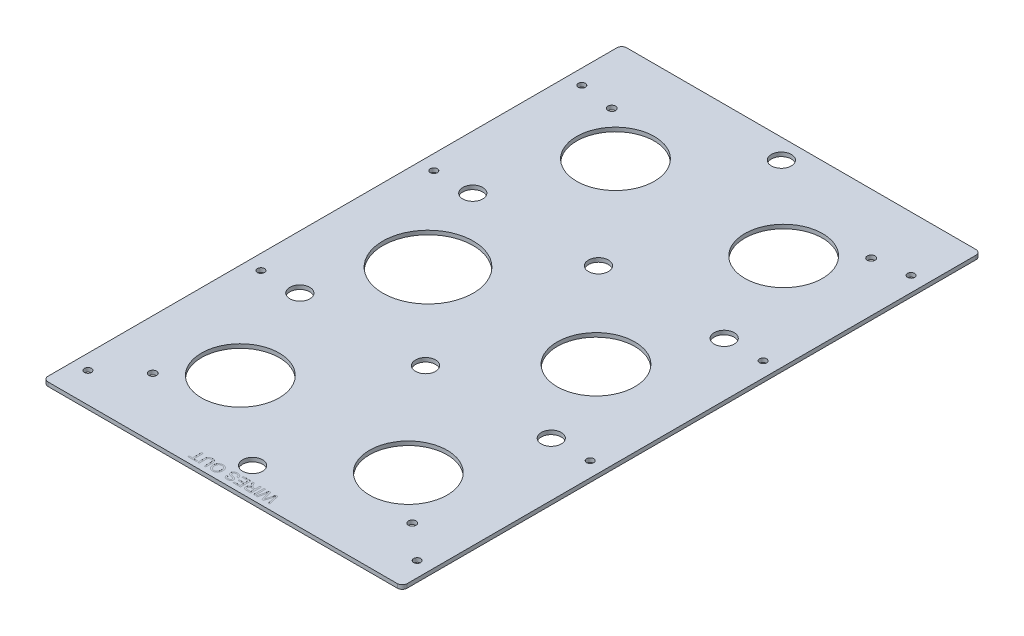
from build123d import *

# Parameters (mm, degrees)
SKETCH1_R           = 24.727
SKETCH1_R_2         = 28.76928198
SKETCH1_R_3         = 6.35
SKETCH1_R_4         = 2.45745
SKETCH1_R_5         = 2.2479
BOSS_EXTRUDE1_DEPTH = 2.54
SKETCH2_W           = 0.941716851
SKETCH2_H           = 6.677628581
CUT_EXTRUDE2_DEPTH  = 0.0254


with BuildPart() as part:
    # Sketch1 → Boss-Extrude1 (new body)
    with BuildSketch(Plane(origin=(0, 0, 0), x_dir=(1, 0, 0), z_dir=(0, 1, 0))):
        with BuildLine():
            Line((-56.121310553, 212.595268584), (166.128689447, 212.595268584))
            ThreePointArc((166.128689447, 212.595268584), (168.373753477, 211.665332614), (169.303689447, 209.420268584))
            Line((169.303689447, 209.420268584), (169.303689447, -152.529731416))
            ThreePointArc((169.303689447, -152.529731416), (168.373753477, -154.774795446), (166.128689447, -155.704731416))
            Line((166.128689447, -155.704731416), (-56.121310553, -155.704731416))
            ThreePointArc((-56.121310553, -155.704731416), (-58.366374583, -154.774795446), (-59.296310553, -152.529731416))
            Line((-59.296310553, -152.529731416), (-59.296310553, 209.420268584))
            ThreePointArc((-59.296310553, 209.420268584), (-58.366374583, 211.665332614), (-56.121310553, 212.595268584))
        make_face()
        with Locations(Location((108.521489447, -91.0633131, 0), (0, 0, 270))):
            Circle(SKETCH1_R, mode=Mode.SUBTRACT)
        with Locations(Location((108.521489447, 28.380977742, 0), (0, 0, 270))):
            Circle(SKETCH1_R, mode=Mode.SUBTRACT)
        with Locations(Location((1.485889447, -90.934731416, 0), (0, 0, 270))):
            Circle(SKETCH1_R, mode=Mode.SUBTRACT)
        with Locations(Location((1.485889447, 147.825268584, 0), (0, 0, 270))):
            Circle(SKETCH1_R, mode=Mode.SUBTRACT)
        with Locations(Location((108.521489447, 147.825268584, 0), (0, 0, 270))):
            Circle(SKETCH1_R, mode=Mode.SUBTRACT)
        with Locations(Location((1.485889447, 28.509559426, 0), (0, 0, 270))):
            Circle(SKETCH1_R_2, mode=Mode.SUBTRACT)
        with Locations(Location((55.003689447, -136.654731416, 0), (0, 0, 270))):
            Circle(SKETCH1_R_3, mode=Mode.SUBTRACT)
        with Locations(Location((135.013689447, -26.583831416, 0), (0, 0, 270))):
            Circle(SKETCH1_R_3, mode=Mode.SUBTRACT)
        with Locations(Location((55.003689447, -26.588064749, 0), (0, 0, 270))):
            Circle(SKETCH1_R_3, mode=Mode.SUBTRACT)
        with Locations(Location((-25.006310553, -26.583831416, 0), (0, 0, 270))):
            Circle(SKETCH1_R_3, mode=Mode.SUBTRACT)
        with Locations(Location((135.013689447, 83.474368584, 0), (0, 0, 270))):
            Circle(SKETCH1_R_3, mode=Mode.SUBTRACT)
        with Locations(Location((55.003689447, 83.478601917, 0), (0, 0, 270))):
            Circle(SKETCH1_R_3, mode=Mode.SUBTRACT)
        with Locations(Location((-25.006310553, 83.474368584, 0), (0, 0, 270))):
            Circle(SKETCH1_R_3, mode=Mode.SUBTRACT)
        with Locations(Location((55.003689447, 199.895268584, 0), (0, 0, 270))):
            Circle(SKETCH1_R_3, mode=Mode.SUBTRACT)
        with Locations(Location((137.553689447, 174.495268584, 0), (0, 0, 270))):
            Circle(SKETCH1_R_4, mode=Mode.SUBTRACT)
        with Locations(Location((-27.546310553, 174.495268584, 0), (0, 0, 270))):
            Circle(SKETCH1_R_4, mode=Mode.SUBTRACT)
        with Locations(Location((-27.546310553, -117.604731416, 0), (0, 0, 270))):
            Circle(SKETCH1_R_4, mode=Mode.SUBTRACT)
        with Locations(Location((137.553689447, -117.604731416, 0), (0, 0, 270))):
            Circle(SKETCH1_R_4, mode=Mode.SUBTRACT)
        with Locations(Location((-49.771310553, 177.670268584, 0), (0, 0, 270))):
            Circle(SKETCH1_R_5, mode=Mode.SUBTRACT)
        with Locations(Location((-49.771310553, 83.478601917, 0), (0, 0, 270))):
            Circle(SKETCH1_R_5, mode=Mode.SUBTRACT)
        with Locations(Location((159.778689447, 177.670268584, 0), (0, 0, 270))):
            Circle(SKETCH1_R_5, mode=Mode.SUBTRACT)
        with Locations(Location((159.778689447, 83.478601917, 0), (0, 0, 270))):
            Circle(SKETCH1_R_5, mode=Mode.SUBTRACT)
        with Locations(Location((159.778689447, -26.588064749, 0), (0, 0, 270))):
            Circle(SKETCH1_R_5, mode=Mode.SUBTRACT)
        with Locations(Location((-49.771310553, -26.588064749, 0), (0, 0, 270))):
            Circle(SKETCH1_R_5, mode=Mode.SUBTRACT)
        with Locations(Location((-49.771310553, -136.654731416, 0), (0, 0, 270))):
            Circle(SKETCH1_R_5, mode=Mode.SUBTRACT)
        with Locations(Location((159.778689447, -136.654731416, 0), (0, 0, 270))):
            Circle(SKETCH1_R_5, mode=Mode.SUBTRACT)
    extrude(amount=BOSS_EXTRUDE1_DEPTH)

    # Sketch2 → Cut-Extrude2 (cut)
    # profile 1 of 8: a face of its own
    with BuildSketch(Plane(origin=(0, 2.54, 0), x_dir=(1, 0, 0), z_dir=(0, 1, 0))):
        with BuildLine():
            Line((80.029279661, -145.704731416), (81.7107258, -152.382359997))
            Line((81.7107258, -152.382359997), (80.738242631, -152.382359997))
            Line((80.738242631, -152.382359997), (79.747032138, -147.990802579))
            add(Edge.make_bspline(
                [(79.747032138, -147.990802579), (79.695661446, -147.764312224), (79.593444513, -147.313643795), (79.492338116, -146.862724924), (79.442044295, -146.638422271)],
                knots=[0, 0, 0, 0, 1.00513078, 2, 2, 2, 2], degree=3))
            add(Edge.make_bspline(
                [(79.442044295, -146.638422271), (79.418231748, -146.719075954), (79.373278, -146.87133541), (79.312509244, -147.08717786), (79.25731493, -147.27555915), (79.210292208, -147.437357484), (79.172218091, -147.572800178), (79.139345331, -147.680222921), (79.116939668, -147.761729399), (79.103662032, -147.806664191), (79.098264137, -147.824931997)],
                knots=[0, 0, 0, 0, 1.633809233, 3.084334118, 4.356383392, 5.447555203, 6.357852567, 7.089694452, 7.629924063, 8, 8, 8, 8], degree=3))
            Line((79.098264137, -147.824931997), (77.779325479, -152.382359997))
            Line((77.779325479, -152.382359997), (76.646322393, -152.382359997))
            Line((76.646322393, -152.382359997), (75.692566548, -149.036857377))
            add(Edge.make_bspline(
                [(75.692566548, -149.036857377), (75.639932506, -148.830185346), (75.536149567, -148.422672829), (75.398257182, -147.81566784), (75.270986917, -147.223388915), (75.197676855, -146.831660892), (75.161513153, -146.638422271)],
                knots=[0, 0, 0, 0, 1.04154457, 2.053700482, 3.039894486, 4, 4, 4, 4], degree=3))
            add(Edge.make_bspline(
                [(75.161513153, -146.638422271), (75.139132616, -146.736944292), (75.091854028, -146.94507076), (75.019147923, -147.273539991), (74.936629564, -147.63395597), (74.880486071, -147.885100536), (74.851174645, -148.016218233)],
                knots=[0, 0, 0, 0, 0.858436457, 1.813435672, 2.858437265, 4, 4, 4, 4], degree=3))
            Line((74.851174645, -148.016218233), (73.865314817, -152.382359997))
            Line((73.865314817, -152.382359997), (72.892831648, -152.382359997))
            Line((72.892831648, -152.382359997), (74.575615453, -145.704731416))
            Line((74.575615453, -145.704731416), (75.610968923, -145.704731416))
            Line((75.610968923, -145.704731416), (77.006154542, -150.807927136))
            add(Edge.make_bspline(
                [(77.006154542, -150.807927136), (77.020164215, -150.857815617), (77.046777378, -150.952585154), (77.081661001, -151.087824496), (77.116254037, -151.206761932), (77.143769386, -151.310934535), (77.167581617, -151.399292569), (77.188668366, -151.471577335), (77.202230796, -151.529203562), (77.212038516, -151.561956596), (77.216168101, -151.57574741)],
                knots=[0, 0, 0, 0, 1.562239628, 2.967673567, 4.210417925, 5.296319877, 6.215971374, 6.969386481, 7.566055473, 8, 8, 8, 8], degree=3))
            add(Edge.make_bspline(
                [(77.216168101, -151.57574741), (77.240993719, -151.488311611), (77.288018835, -151.322689209), (77.356503208, -151.089823335), (77.415382597, -150.885483445), (77.452024197, -150.759319766), (77.468986972, -150.700913858)],
                knots=[0, 0, 0, 0, 1.197732026, 2.268764715, 3.198546125, 4, 4, 4, 4], degree=3))
            Line((77.468986972, -150.700913858), (78.915003898, -145.704731416))
            Line((78.915003898, -145.704731416), (80.029279661, -145.704731416))
        make_face()
    # profile 2 of 8: a face of its own
    with BuildSketch(Plane(origin=(0, 2.54, 0), x_dir=(1, 0, 0), z_dir=(0, 1, 0))):
        with Locations((71.737088239, -149.043545707)):
            Rectangle(SKETCH2_W, SKETCH2_H)
    # profile 3 of 8: a face of its own
    with BuildSketch(Plane(origin=(0, 2.54, 0), x_dir=(1, 0, 0), z_dir=(0, 1, 0))):
        with BuildLine():
            Line((69.725238603, -145.704731416), (69.725238603, -152.382359997))
            Line((69.725238603, -152.382359997), (66.827854087, -152.382359997))
            add(Edge.make_bspline(
                [(66.827854087, -152.382359997), (66.759629228, -152.381827962), (66.627588, -152.380798272), (66.436106253, -152.373440351), (66.25779954, -152.357808443), (66.091544097, -152.340349513), (65.937624411, -152.314571062), (65.795967128, -152.28432829), (65.667115536, -152.248584849), (65.550089215, -152.20633462), (65.441505485, -152.158550478), (65.340885212, -152.099559989), (65.243907957, -152.035030329), (65.154439449, -151.958586204), (65.068450058, -151.876455256), (64.989539904, -151.78452804), (64.915373648, -151.685105409), (64.825197278, -151.541131601), (64.730487537, -151.348144969), (64.648912432, -151.102957418), (64.597041436, -150.846216607), (64.591442148, -150.670841687), (64.588601234, -150.581861585)],
                knots=[0, 0, 0, 0, 1.242075696, 2.40389213, 3.487198984, 4.500157661, 5.446319301, 6.326791195, 7.136300648, 7.878370406, 8.590488565, 9.292260633, 9.999224673, 10.708050372, 11.431369221, 12.162165018, 12.910600795, 13.687589445, 15.252257874, 16.810406251, 18.381693487, 20, 20, 20, 20], degree=3))
            add(Edge.make_bspline(
                [(64.588601234, -150.581861585), (64.589907939, -150.524740088), (64.592488773, -150.411921213), (64.612257927, -150.246047086), (64.648029381, -150.087561728), (64.693896712, -149.935073876), (64.756684454, -149.790755988), (64.829388085, -149.651615869), (64.919584598, -149.521641487), (65.020293841, -149.396488972), (65.13740046, -149.281806219), (65.267662733, -149.175811763), (65.41499687, -149.084850699), (65.574570578, -149.000318383), (65.750496328, -148.930895346), (65.940120993, -148.869766111), (66.14491216, -148.822633746), (66.286855968, -148.798892657), (66.359670993, -148.786713838)],
                knots=[0, 0, 0, 0, 0.982645791, 1.940792824, 2.867691729, 3.775150443, 4.675643875, 5.571354211, 6.471357401, 7.392684514, 8.331098131, 9.285922955, 10.275520706, 11.304845665, 12.388884831, 13.524255008, 14.729980297, 16, 16, 16, 16], degree=3))
            add(Edge.make_bspline(
                [(66.359670993, -148.786713838), (66.305740634, -148.75983205), (66.203466532, -148.708853145), (66.064293374, -148.624504804), (65.942371498, -148.545098059), (65.873114839, -148.485554196), (65.840656592, -148.457648007)],
                knots=[0, 0, 0, 0, 1.172551213, 2.223638478, 3.167479604, 4, 4, 4, 4], degree=3))
            add(Edge.make_bspline(
                [(65.840656592, -148.457648007), (65.777468442, -148.395895573), (65.64787995, -148.2692515), (65.471039527, -148.051539052), (65.296058038, -147.81211767), (65.191002805, -147.6376469), (65.137044286, -147.548035139)],
                knots=[0, 0, 0, 0, 0.918170575, 1.883016652, 2.912673989, 4, 4, 4, 4], degree=3))
            Line((65.137044286, -147.548035139), (64.041495847, -145.704731416))
            Line((64.041495847, -145.704731416), (65.120992294, -145.704731416))
            Line((65.120992294, -145.704731416), (65.953020535, -147.114631361))
            add(Edge.make_bspline(
                [(65.953020535, -147.114631361), (65.982937923, -147.164098167), (66.040912909, -147.259956715), (66.12462569, -147.399973664), (66.206813768, -147.528808538), (66.282671411, -147.650471976), (66.357009397, -147.761755466), (66.423648427, -147.866870579), (66.490571396, -147.959862494), (66.567413815, -148.071581699), (66.661257567, -148.192370364), (66.770766589, -148.316455456), (66.871452849, -148.419242035), (66.998685638, -148.517314097), (67.156892938, -148.607108645), (67.290284254, -148.649704776), (67.354894484, -148.670336898)],
                knots=[0, 0, 0, 0, 1.130591283, 2.190900266, 3.190104209, 4.119071823, 4.994606968, 5.807262858, 6.55236009, 7.234593472, 8.459046683, 9.540234366, 10.471327768, 11.266723835, 12.676093724, 14, 14, 14, 14], degree=3))
            add(Edge.make_bspline(
                [(67.354894484, -148.670336898), (67.382037121, -148.675231638), (67.444004575, -148.686406476), (67.549225158, -148.69370478), (67.676712802, -148.701450954), (67.769105271, -148.701225256), (67.819064579, -148.701103215)],
                knots=[0, 0, 0, 0, 0.709978628, 1.620902492, 2.713552433, 4, 4, 4, 4], degree=3))
            Line((67.819064579, -148.701103215), (68.783521752, -148.701103215))
            Line((68.783521752, -148.701103215), (68.783521752, -145.704731416))
            Line((68.783521752, -145.704731416), (69.725238603, -145.704731416))
        make_face()
        with BuildLine():
            Line((68.783521752, -149.471598821), (66.995062335, -149.471598821))
            add(Edge.make_bspline(
                [(66.995062335, -149.471598821), (66.905378152, -149.472989815), (66.737721983, -149.47559015), (66.503340952, -149.498134703), (66.302851091, -149.533375071), (66.133691433, -149.586899254), (65.991529233, -149.658578696), (65.868316922, -149.746235717), (65.764716885, -149.854984869), (65.679514802, -149.97968191), (65.612910025, -150.115575815), (65.566369983, -150.259402832), (65.53512463, -150.408405004), (65.531929843, -150.510360449), (65.530318085, -150.561796596)],
                knots=[0, 0, 0, 0, 1.546056516, 2.890207646, 4.055830773, 5.050253158, 5.937355789, 6.790906573, 7.644595853, 8.512568064, 9.38593768, 10.244184789, 11.114197691, 12, 12, 12, 12], degree=3))
            add(Edge.make_bspline(
                [(65.530318085, -150.561796596), (65.531555421, -150.599281171), (65.533978998, -150.672702444), (65.546819416, -150.78042932), (65.571249426, -150.882517958), (65.604983943, -150.979704261), (65.647696765, -151.072199236), (65.700184065, -151.159639095), (65.762175013, -151.241577229), (65.833285898, -151.318417024), (65.91490542, -151.38834434), (66.008142078, -151.448673601), (66.112251337, -151.49994125), (66.227356803, -151.540630467), (66.353095126, -151.573175281), (66.490182326, -151.59482628), (66.637991409, -151.610492876), (66.740414535, -151.611398678), (66.793074771, -151.611864391)],
                knots=[0, 0, 0, 0, 0.965235723, 1.89061323, 2.787065514, 3.661873922, 4.534873316, 5.404925039, 6.281839248, 7.175200054, 8.095223355, 9.040740021, 10.02630299, 11.075573487, 12.177989335, 13.364883635, 14.645170704, 16, 16, 16, 16], degree=3))
            Line((66.793074771, -151.611864391), (68.783521752, -151.611864391))
            Line((68.783521752, -151.611864391), (68.783521752, -149.471598821))
        make_face(mode=Mode.SUBTRACT)
    # profile 4 of 8: a face of its own
    with BuildSketch(Plane(origin=(0, 2.54, 0), x_dir=(1, 0, 0), z_dir=(0, 1, 0))):
        Polygon((63.047610023, -145.704731416), (63.047610023, -152.382359997), (58.339025767, -152.382359997), (58.339025767, -151.611864391), (62.105893172, -151.611864391), (62.105893172, -149.557209443), (58.595857635, -149.557209443), (58.595857635, -148.786713838), (62.105893172, -148.786713838), (62.105893172, -146.475227022), (58.167804521, -146.475227022), (58.167804521, -145.704731416), align=None)
    # profile 5 of 8: a face of its own
    with BuildSketch(Plane(origin=(0, 2.54, 0), x_dir=(1, 0, 0), z_dir=(0, 1, 0))):
        with BuildLine():
            Line((57.22608767, -148.016218233), (56.284370819, -148.016218233))
            add(Edge.make_bspline(
                [(56.284370819, -148.016218233), (56.274036117, -147.931652183), (56.254182596, -147.769196247), (56.198230694, -147.539143921), (56.127744398, -147.331765305), (56.034997955, -147.147273237), (55.92108129, -146.981277245), (55.778553671, -146.834274944), (55.607402601, -146.705232553), (55.411663162, -146.594893332), (55.197484631, -146.5019483), (54.966757588, -146.436745749), (54.722897055, -146.39720687), (54.55581207, -146.392182119), (54.470495748, -146.389616399)],
                knots=[0, 0, 0, 0, 1.125761249, 2.162647979, 3.12492346, 4.01623828, 4.884793378, 5.777219259, 6.711258599, 7.709587174, 8.742442187, 9.791331093, 10.872217593, 12, 12, 12, 12], degree=3))
            add(Edge.make_bspline(
                [(54.470495748, -146.389616399), (54.395012142, -146.391020079), (54.248275368, -146.39374877), (54.035161199, -146.426314589), (53.835192167, -146.474492858), (53.650528629, -146.543784278), (53.484881741, -146.630884243), (53.337848957, -146.730338577), (53.21590082, -146.848862493), (53.117256921, -146.97986137), (53.040703733, -147.118970535), (52.987333539, -147.262482959), (52.951401229, -147.407604013), (52.947495522, -147.505916251), (52.945556529, -147.554723469)],
                knots=[0, 0, 0, 0, 1.267544124, 2.464049433, 3.614542348, 4.719673496, 5.768837234, 6.754183997, 7.692231426, 8.612479311, 9.501217876, 10.350240008, 11.180974857, 12, 12, 12, 12], degree=3))
            add(Edge.make_bspline(
                [(52.945556529, -147.554723469), (52.947602205, -147.603051819), (52.951604584, -147.697606546), (52.983354602, -147.83448118), (53.034659483, -147.961839203), (53.106627636, -148.080767085), (53.204438753, -148.190545656), (53.330920283, -148.287996323), (53.482548856, -148.38068759), (53.596709803, -148.430119962), (53.657194831, -148.456310341)],
                knots=[0, 0, 0, 0, 0.942081658, 1.843188798, 2.725198023, 3.611401405, 4.541884661, 5.575766242, 6.715586633, 8, 8, 8, 8], degree=3))
            add(Edge.make_bspline(
                [(53.657194831, -148.456310341), (53.680720403, -148.465964594), (53.733868945, -148.487775307), (53.824963937, -148.516645948), (53.933055061, -148.553995036), (54.060353956, -148.592260466), (54.206992519, -148.633260146), (54.371625653, -148.680444223), (54.555559453, -148.729579011), (54.752352418, -148.781595403), (54.951550784, -148.834355039), (55.141834246, -148.888300752), (55.317983836, -148.939465805), (55.479329045, -148.99205191), (55.626024384, -149.043952649), (55.758470628, -149.094832643), (55.876903383, -149.143425756), (55.949235832, -149.179162423), (55.983395973, -149.196039628)],
                knots=[0, 0, 0, 0, 0.499208779, 1.12780332, 1.87546358, 2.745246929, 3.737578632, 4.865834649, 6.108484299, 7.476352792, 8.863398792, 10.155242256, 11.360521946, 12.465428895, 13.487415091, 14.415997097, 15.251929613, 16, 16, 16, 16], degree=3))
            add(Edge.make_bspline(
                [(55.983395973, -149.196039628), (56.061939332, -149.238549093), (56.213548457, -149.320603422), (56.418387849, -149.466445689), (56.588087262, -149.631435602), (56.728032509, -149.809204512), (56.836079416, -150.000673688), (56.912416665, -150.203746025), (56.96199253, -150.417629242), (56.96680774, -150.56464044), (56.969255802, -150.639381223)],
                knots=[0, 0, 0, 0, 1.158956011, 2.237086722, 3.252429106, 4.221720014, 5.165272549, 6.094237939, 7.031106807, 8, 8, 8, 8], degree=3))
            add(Edge.make_bspline(
                [(56.969255802, -150.639381223), (56.966081922, -150.722169384), (56.959769099, -150.886834437), (56.903631, -151.128422791), (56.814219476, -151.361652776), (56.711224913, -151.546243423), (56.612252857, -151.686400222), (56.529071871, -151.785780629), (56.437284812, -151.878203422), (56.33889894, -151.965586195), (56.230361925, -152.044661593), (56.114924838, -152.118074619), (55.990222979, -152.183860466), (55.81367115, -152.264065642), (55.578842787, -152.346297072), (55.283173868, -152.417541618), (54.971970371, -152.459247391), (54.759556851, -152.465021748), (54.651080655, -152.46797062)],
                knots=[0, 0, 0, 0, 1.200056028, 2.386902731, 3.579012093, 4.815906327, 5.442508847, 6.067203999, 6.694073756, 7.331409728, 7.974631341, 8.640655778, 9.315145047, 10.018831381, 11.453504181, 12.917815188, 14.425977399, 16, 16, 16, 16], degree=3))
            add(Edge.make_bspline(
                [(54.651080655, -152.46797062), (54.532328079, -152.465335452), (54.301536136, -152.460214087), (53.965948585, -152.415048168), (53.652011121, -152.342269778), (53.406259629, -152.256526219), (53.224097329, -152.171298161), (53.09569649, -152.102618852), (52.976105466, -152.025216619), (52.863042146, -151.943262026), (52.760547182, -151.851416675), (52.664387424, -151.75451086), (52.576180596, -151.650676539), (52.471432464, -151.502375157), (52.360787582, -151.304042733), (52.26086547, -151.049659933), (52.196879074, -150.779183734), (52.182410966, -150.5933387), (52.175060923, -150.498926295)],
                knots=[0, 0, 0, 0, 1.607451709, 3.124032445, 4.575401297, 5.965664223, 6.638286369, 7.297495781, 7.935629741, 8.566004073, 9.186263309, 9.796807256, 10.413736732, 11.028594479, 12.253110936, 13.478624344, 14.719098735, 16, 16, 16, 16], degree=3))
            Line((52.175060923, -150.498926295), (53.116777774, -150.498926295))
            add(Edge.make_bspline(
                [(53.116777774, -150.498926295), (53.12256482, -150.546790135), (53.1339, -150.640541808), (53.165699429, -150.775279325), (53.203736155, -150.901835006), (53.252104235, -151.018786484), (53.309830176, -151.127167922), (53.37830271, -151.225743174), (53.454811782, -151.316377881), (53.541203273, -151.397481453), (53.638294539, -151.46870712), (53.746105914, -151.530263898), (53.864237666, -151.582876538), (53.993835671, -151.623436732), (54.133167052, -151.657118748), (54.283834793, -151.681296537), (54.445312172, -151.693821225), (54.556533166, -151.696235632), (54.613626008, -151.697475014)],
                knots=[0, 0, 0, 0, 1.074256797, 2.104164074, 3.082231143, 4.018364317, 4.921387537, 5.814946689, 6.689553043, 7.561782592, 8.450683137, 9.368204304, 10.325224224, 11.328240899, 12.391723181, 13.519579538, 14.726730929, 16, 16, 16, 16], degree=3))
            add(Edge.make_bspline(
                [(54.613626008, -151.697475014), (54.672972195, -151.697033587), (54.787851817, -151.696179094), (54.95388876, -151.680315804), (55.107908151, -151.658931698), (55.248960533, -151.626106316), (55.378362134, -151.587486496), (55.493843198, -151.535627275), (55.598156125, -151.477168085), (55.689398524, -151.408644046), (55.768042412, -151.332675231), (55.838626331, -151.254638279), (55.895538928, -151.17045065), (55.9456534, -151.084774031), (55.980571056, -150.99305167), (56.007980626, -150.899274119), (56.024647148, -150.801380567), (56.026561696, -150.734865537), (56.027538951, -150.700913858)],
                knots=[0, 0, 0, 0, 1.464224776, 2.834379057, 4.11387117, 5.299348816, 6.406355048, 7.441191667, 8.417293255, 9.352838038, 10.248153785, 11.113750317, 11.944205591, 12.75240885, 13.557683963, 14.358962649, 15.162355132, 16, 16, 16, 16], degree=3))
            add(Edge.make_bspline(
                [(56.027538951, -150.700913858), (56.025105333, -150.643462477), (56.020381904, -150.531954643), (55.972148797, -150.373535625), (55.89796594, -150.229126425), (55.824884006, -150.150554117), (55.78809674, -150.11100316)],
                knots=[0, 0, 0, 0, 1.050964922, 2.039826012, 3.013306874, 4, 4, 4, 4], degree=3))
            add(Edge.make_bspline(
                [(55.78809674, -150.11100316), (55.764906441, -150.091237481), (55.713622525, -150.047526901), (55.618200873, -149.989681153), (55.499892293, -149.931234951), (55.357905621, -149.873137007), (55.192488119, -149.814670252), (55.003893205, -149.754515149), (54.791046034, -149.694461366), (54.56099498, -149.637528445), (54.328914973, -149.579071519), (54.108668391, -149.52147128), (53.905664624, -149.467642831), (53.722241075, -149.41160268), (53.555379549, -149.362447621), (53.408387696, -149.31054747), (53.278624712, -149.263448691), (53.199158703, -149.230204154), (53.162258418, -149.214766952)],
                knots=[0, 0, 0, 0, 0.523895407, 1.158562347, 1.913798076, 2.79478753, 3.797549825, 4.933675542, 6.202127117, 7.604032848, 9.013379355, 10.32225155, 11.523321485, 12.628397413, 13.623935419, 14.51727859, 15.311493772, 16, 16, 16, 16], degree=3))
            add(Edge.make_bspline(
                [(53.162258418, -149.214766952), (53.114237299, -149.192642663), (53.019979891, -149.14921639), (52.886607207, -149.074857982), (52.761347407, -148.998303761), (52.648100997, -148.913945073), (52.541303271, -148.829473553), (52.446401397, -148.738152653), (52.361353982, -148.64213119), (52.260611548, -148.510201197), (52.157272926, -148.332129366), (52.068486422, -148.101983909), (52.012948169, -147.856092742), (52.006913414, -147.68655586), (52.003839678, -147.600204112)],
                knots=[0, 0, 0, 0, 0.899363591, 1.76530001, 2.59691609, 3.395188894, 4.166615117, 4.912545108, 5.632755751, 6.347510175, 7.734752518, 9.118421309, 10.532299558, 12, 12, 12, 12], degree=3))
            add(Edge.make_bspline(
                [(52.003839678, -147.600204112), (52.007379693, -147.512947481), (52.014425473, -147.339278427), (52.073306705, -147.083670735), (52.167783661, -146.836498404), (52.277131577, -146.640406238), (52.380908177, -146.490405381), (52.46805695, -146.382582695), (52.564707583, -146.282886624), (52.66847164, -146.188190253), (52.780157577, -146.100428246), (52.90070475, -146.019563988), (53.028847063, -145.944780918), (53.211805644, -145.853551254), (53.455094931, -145.758813104), (53.764044377, -145.676641079), (54.090829604, -145.627950211), (54.314714943, -145.622105191), (54.429028102, -145.619120793)],
                knots=[0, 0, 0, 0, 1.196987384, 2.382393894, 3.582009067, 4.820735309, 5.454243406, 6.085350439, 6.72189866, 7.359035515, 8.013098289, 8.67027723, 9.350744424, 10.048966745, 11.475869723, 12.9268444, 14.430883741, 16, 16, 16, 16], degree=3))
            add(Edge.make_bspline(
                [(54.429028102, -145.619120793), (54.501724447, -145.619797777), (54.644571207, -145.621128036), (54.854009777, -145.63431666), (55.054143614, -145.658144771), (55.245773398, -145.685725106), (55.427995129, -145.727177668), (55.601854388, -145.773949607), (55.765765293, -145.832626587), (55.921532804, -145.897184112), (56.067730879, -145.973465379), (56.207429169, -146.055221012), (56.337247096, -146.149004708), (56.461030966, -146.248461662), (56.575045939, -146.359105701), (56.680611206, -146.478354849), (56.77887416, -146.605938118), (56.868092721, -146.741993436), (56.947740021, -146.884960745), (57.019442486, -147.03235512), (57.07944818, -147.184962788), (57.128897857, -147.342424979), (57.169375954, -147.504026887), (57.19823807, -147.670844972), (57.219190157, -147.841832706), (57.223774919, -147.957746378), (57.22608767, -148.016218233)],
                knots=[0, 0, 0, 0, 1.259929758, 2.475735005, 3.634725603, 4.752877801, 5.82919746, 6.871690464, 7.871395985, 8.84458164, 9.791640072, 10.727373556, 11.647336026, 12.564665335, 13.477425593, 14.397128332, 15.323044476, 16.266184727, 17.214251675, 18.157898412, 19.105082968, 20.053433368, 21.01687335, 21.990151059, 22.98614553, 24, 24, 24, 24], degree=3))
        make_face()
    # profile 6 of 8: a face of its own
    with BuildSketch(Plane(origin=(0, 2.54, 0), x_dir=(1, 0, 0), z_dir=(0, 1, 0))):
        with BuildLine():
            add(Edge.make_bspline(
                [(48.493804142, -148.955259752), (48.491467599, -149.089135529), (48.486914966, -149.349985692), (48.444878562, -149.729899077), (48.375530549, -150.086921252), (48.280135178, -150.422703732), (48.153256187, -150.734714085), (48.002707821, -151.026789018), (47.820043627, -151.293844928), (47.613644944, -151.538969607), (47.383043857, -151.755657917), (47.137535236, -151.948113422), (46.874034222, -152.108642761), (46.59498038, -152.241187416), (46.299186796, -152.342951276), (45.987484329, -152.414195261), (45.660206242, -152.460154548), (45.436504015, -152.465327419), (45.322198099, -152.46797062)],
                knots=[0, 0, 0, 0, 1.203593535, 2.345140965, 3.431924157, 4.471254512, 5.478692091, 6.45615896, 7.42038538, 8.382007041, 9.33218277, 10.260966195, 11.182476517, 12.100814648, 13.034113903, 13.98924309, 14.972556454, 16, 16, 16, 16], degree=3))
            add(Edge.make_bspline(
                [(45.322198099, -152.46797062), (45.246803118, -152.466666047), (45.097082322, -152.464075401), (44.875336318, -152.443970034), (44.659554943, -152.409061507), (44.449611732, -152.360498158), (44.245197005, -152.299400427), (44.04644571, -152.223941082), (43.853040257, -152.135665273), (43.666712333, -152.033067288), (43.488785231, -151.917618035), (43.319985167, -151.79251744), (43.162934584, -151.655256349), (43.016875567, -151.507656459), (42.880679081, -151.349793667), (42.758697678, -151.178719662), (42.643711434, -150.999837338), (42.542898006, -150.809040243), (42.451508274, -150.610712696), (42.374904164, -150.403995115), (42.307064707, -150.191850055), (42.252288146, -149.972959882), (42.211457264, -149.746700078), (42.180059978, -149.514696505), (42.163106161, -149.275659739), (42.160126709, -149.114465609), (42.158618052, -149.032844379)],
                knots=[0, 0, 0, 0, 1.034176269, 2.053687022, 3.051235935, 4.030520976, 5.007759882, 5.975670013, 6.944584641, 7.921900115, 8.890679583, 9.85222947, 10.801660264, 11.7488817, 12.698942795, 13.658174729, 14.62880618, 15.613957309, 16.61577279, 17.622338666, 18.636016077, 19.670029534, 20.714984856, 21.788550191, 22.880224384, 24, 24, 24, 24], degree=3))
            add(Edge.make_bspline(
                [(42.158618052, -149.032844379), (42.160009382, -148.949878825), (42.162758195, -148.785966068), (42.181357784, -148.543816775), (42.214062327, -148.308619086), (42.257439336, -148.079671684), (42.315563203, -147.85745119), (42.384634487, -147.641320483), (42.468180105, -147.432566885), (42.562535617, -147.230687242), (42.669298792, -147.038458153), (42.787065988, -146.857223581), (42.915919864, -146.688679534), (43.053905959, -146.530755832), (43.203783041, -146.38672136), (43.364393449, -146.254432261), (43.535408741, -146.13445772), (43.716158567, -146.026090066), (43.903755164, -145.93080257), (44.095920731, -145.846594873), (44.292881899, -145.778463632), (44.49175709, -145.718034174), (44.695507697, -145.674582309), (44.90221245, -145.642203665), (45.113170034, -145.623270241), (45.254832495, -145.62051105), (45.326211097, -145.619120793)],
                knots=[0, 0, 0, 0, 1.141458971, 2.255149016, 3.338763392, 4.407145747, 5.45911027, 6.497028761, 7.526847988, 8.550472592, 9.561035647, 10.549629976, 11.521388012, 12.477647518, 13.432134385, 14.377847498, 15.337760086, 16.303574593, 17.274809663, 18.230970776, 19.187525402, 20.140611526, 21.088808525, 22.051011914, 23.017975238, 24, 24, 24, 24], degree=3))
            add(Edge.make_bspline(
                [(45.326211097, -145.619120793), (45.402948895, -145.620309681), (45.554947256, -145.62266457), (45.779842351, -145.644345492), (45.998398809, -145.681460676), (46.211866877, -145.728050436), (46.41787104, -145.793461052), (46.618134934, -145.870530878), (46.811173889, -145.963796859), (46.997979616, -146.069154763), (47.176878716, -146.185959466), (47.344078236, -146.315335396), (47.502045211, -146.452739616), (47.645968618, -146.603499345), (47.780158847, -146.762898302), (47.90416524, -146.932319795), (48.016235608, -147.112612503), (48.115748903, -147.302812003), (48.20548349, -147.498091438), (48.281127756, -147.698348896), (48.347593196, -147.900677047), (48.40052896, -148.10631126), (48.442711581, -148.314780295), (48.471076513, -148.525736434), (48.491561832, -148.739494085), (48.493052944, -148.882975927), (48.493804142, -148.955259752)],
                knots=[0, 0, 0, 0, 1.072846099, 2.125039441, 3.155166917, 4.171599398, 5.177324298, 6.174217088, 7.169783185, 8.172042761, 9.17156421, 10.154239632, 11.126115549, 12.096189878, 13.065322046, 14.038037562, 15.029377678, 16.03062832, 17.03785952, 18.032507603, 19.022297599, 20.014323703, 20.999862951, 21.994471951, 22.989647507, 24, 24, 24, 24], degree=3))
        make_face()
        with BuildLine():
            add(Edge.make_bspline(
                [(47.55208729, -148.944558424), (47.550644971, -148.848151817), (47.547832551, -148.660165739), (47.515627371, -148.386099128), (47.466818619, -148.12747685), (47.399344029, -147.883694112), (47.309257222, -147.656543018), (47.199115485, -147.445587371), (47.069916503, -147.249830078), (46.921728259, -147.071489589), (46.758902041, -146.911226752), (46.584902849, -146.77118446), (46.399892329, -146.654408047), (46.206319995, -146.556869438), (46.001619325, -146.481716297), (45.786771033, -146.428589759), (45.561779333, -146.395428666), (45.408370792, -146.391577959), (45.330224095, -146.389616399)],
                knots=[0, 0, 0, 0, 1.215616022, 2.370365452, 3.475740397, 4.533490648, 5.5560781, 6.552384115, 7.530550651, 8.509299237, 9.471863928, 10.40830403, 11.321168121, 12.226759389, 13.137923578, 14.065605683, 15.014614662, 16, 16, 16, 16], degree=3))
            add(Edge.make_bspline(
                [(45.330224095, -146.389616399), (45.250752104, -146.391605556), (45.095146171, -146.395500319), (44.866772386, -146.428101993), (44.649791707, -146.483604945), (44.442053557, -146.557491975), (44.247313311, -146.657374543), (44.061017796, -146.774336845), (43.888240741, -146.917260032), (43.724759335, -147.077811023), (43.578072709, -147.260286231), (43.448128555, -147.460286468), (43.341842815, -147.680297116), (43.253181458, -147.917154096), (43.183633952, -148.172343821), (43.135013735, -148.445864052), (43.105030043, -148.736993788), (43.101927623, -148.936903238), (43.100334903, -149.039532709)],
                knots=[0, 0, 0, 0, 0.976909331, 1.912785716, 2.828990727, 3.727421029, 4.617481149, 5.514840137, 6.426786422, 7.368873452, 8.327895072, 9.299698503, 10.295216142, 11.325792517, 12.405818789, 13.542541501, 14.738390493, 16, 16, 16, 16], degree=3))
            add(Edge.make_bspline(
                [(43.100334903, -149.039532709), (43.100903486, -149.105554772), (43.102018841, -149.235066167), (43.116789884, -149.425967441), (43.135842608, -149.610930612), (43.164850778, -149.789716918), (43.204827366, -149.961586304), (43.249115828, -150.127845986), (43.304492564, -150.287067658), (43.367340871, -150.43985966), (43.437610453, -150.58549569), (43.517069671, -150.722538432), (43.604030552, -150.8514426), (43.699393953, -150.971632766), (43.800749059, -151.084806113), (43.911322382, -151.188020439), (44.029292399, -151.283329151), (44.15467387, -151.369757222), (44.285454646, -151.447449459), (44.420970996, -151.514452815), (44.560791255, -151.571258814), (44.704771667, -151.615771008), (44.852045916, -151.652520297), (45.002969159, -151.679741754), (45.158723979, -151.694013149), (45.263761115, -151.696312772), (45.316847435, -151.697475014)],
                knots=[0, 0, 0, 0, 1.220320263, 2.393826742, 3.538159925, 4.657606474, 5.739544833, 6.799495376, 7.837090465, 8.853610905, 9.852768056, 10.824163015, 11.779900663, 12.724912201, 13.658747054, 14.586045767, 15.518168864, 16.460299482, 17.399069918, 18.328125852, 19.252745725, 20.186143833, 21.111865538, 22.057883325, 23.018444021, 24, 24, 24, 24], degree=3))
            add(Edge.make_bspline(
                [(45.316847435, -151.697475014), (45.391875075, -151.695959775), (45.54035477, -151.692961117), (45.758313263, -151.660557085), (45.968680565, -151.611773411), (46.169989069, -151.541307864), (46.36453317, -151.452843413), (46.550074066, -151.342701808), (46.727792545, -151.21319321), (46.896933348, -151.064868688), (47.054578213, -150.893751276), (47.187925289, -150.692139307), (47.300292819, -150.464699542), (47.394123674, -150.212050312), (47.465665272, -149.93222286), (47.515109926, -149.626424994), (47.546328144, -149.294333415), (47.550118497, -149.064130757), (47.55208729, -148.944558424)],
                knots=[0, 0, 0, 0, 0.895098135, 1.771399171, 2.624879489, 3.470001555, 4.31324378, 5.172350046, 6.041214072, 6.935108351, 7.854676913, 8.809932058, 9.809814619, 10.877726151, 12.02168834, 13.252153056, 14.572707754, 16, 16, 16, 16], degree=3))
        make_face(mode=Mode.SUBTRACT)
    # profile 7 of 8: a face of its own
    with BuildSketch(Plane(origin=(0, 2.54, 0), x_dir=(1, 0, 0), z_dir=(0, 1, 0))):
        with BuildLine():
            Line((36.765148814, -152.382359997), (35.823431963, -152.382359997))
            Line((35.823431963, -152.382359997), (35.823431963, -148.540583297))
            add(Edge.make_bspline(
                [(35.823431963, -148.540583297), (35.824411412, -148.45897922), (35.826317422, -148.300177551), (35.835036489, -148.068576242), (35.852184402, -147.849869969), (35.877863075, -147.644731811), (35.908551601, -147.451891603), (35.944806741, -147.272000632), (35.991007316, -147.105219306), (36.04286506, -146.949716853), (36.104617166, -146.804123123), (36.177639877, -146.666349763), (36.261564923, -146.535531599), (36.357338455, -146.411956559), (36.46343833, -146.29487412), (36.58111315, -146.185210389), (36.710891012, -146.083724093), (36.849481398, -145.986578671), (37.000533983, -145.899700665), (37.163716279, -145.824763303), (37.337981243, -145.760305959), (37.524177401, -145.708486233), (37.72145024, -145.668884286), (37.929514033, -145.639272061), (38.148883297, -145.621768164), (38.298973885, -145.620016319), (38.375698656, -145.619120793)],
                knots=[0, 0, 0, 0, 1.311377147, 2.551942077, 3.723550895, 4.835332178, 5.873100029, 6.860965504, 7.782222652, 8.65229484, 9.493385443, 10.320318369, 11.155067733, 11.987723446, 12.829729107, 13.691560723, 14.568860379, 15.475173283, 16.409214366, 17.364531151, 18.357450607, 19.391849073, 20.466818896, 21.588529868, 22.767281177, 24, 24, 24, 24], degree=3))
            add(Edge.make_bspline(
                [(38.375698656, -145.619120793), (38.450629239, -145.620223431), (38.596625633, -145.622371835), (38.810568722, -145.63690841), (39.014082344, -145.662643957), (39.207749865, -145.696498272), (39.390617457, -145.741994513), (39.562466619, -145.798599924), (39.724417206, -145.863888639), (39.876665989, -145.938431495), (40.016940359, -146.025159239), (40.148854482, -146.117782697), (40.268506084, -146.222155702), (40.378198887, -146.334346179), (40.478096698, -146.455276232), (40.566242152, -146.586099147), (40.646051113, -146.724938713), (40.712291373, -146.875383033), (40.772095602, -147.035955846), (40.822216924, -147.21003356), (40.865014212, -147.397616374), (40.899056, -147.599137402), (40.927944449, -147.814518169), (40.945146122, -148.044543636), (40.958072597, -148.288063667), (40.959392234, -148.454953209), (40.960069333, -148.540583297)],
                knots=[0, 0, 0, 0, 1.193078897, 2.324621146, 3.412165798, 4.458033356, 5.453301711, 6.409727336, 7.336550967, 8.231923267, 9.10494906, 9.959977801, 10.795507141, 11.62892236, 12.456145611, 13.289107106, 14.138012467, 15.002334476, 15.903094886, 16.864671381, 17.884255983, 18.965082669, 20.117808422, 21.342986352, 22.636701193, 24, 24, 24, 24], degree=3))
            Line((40.960069333, -148.540583297), (40.960069333, -152.382359997))
            Line((40.960069333, -152.382359997), (40.018352481, -152.382359997))
            Line((40.018352481, -152.382359997), (40.018352481, -148.584726275))
            add(Edge.make_bspline(
                [(40.018352481, -148.584726275), (40.017736434, -148.515610273), (40.01654776, -148.382249929), (40.010362879, -148.189060798), (39.997942115, -148.009788524), (39.982777145, -147.844572253), (39.961455997, -147.693653433), (39.934654207, -147.55712261), (39.904365764, -147.434189182), (39.859203509, -147.290303673), (39.783136467, -147.130314323), (39.667922462, -146.957600506), (39.520222528, -146.81256749), (39.349091393, -146.689554724), (39.153532921, -146.593613773), (38.936990082, -146.523776523), (38.699684913, -146.481955602), (38.534608724, -146.477520045), (38.449270285, -146.475227022)],
                knots=[0, 0, 0, 0, 1.090438201, 2.104016592, 3.048763244, 3.925116223, 4.720979001, 5.45216101, 6.119252661, 6.717681473, 7.82855347, 8.901677854, 9.976092604, 11.075141713, 12.213970494, 13.397440122, 14.654570346, 16, 16, 16, 16], degree=3))
            add(Edge.make_bspline(
                [(38.449270285, -146.475227022), (38.376105998, -146.476471385), (38.234833164, -146.478874124), (38.031126537, -146.49828557), (37.8443592, -146.533590543), (37.672656502, -146.579444162), (37.517403502, -146.640928643), (37.377485163, -146.715387077), (37.256601986, -146.80688453), (37.147224682, -146.909593678), (37.05486022, -147.034626717), (36.977676648, -147.183214985), (36.911112399, -147.355481131), (36.856601992, -147.553062546), (36.816794089, -147.776197948), (36.785695273, -148.023492495), (36.769383832, -148.29602024), (36.766601124, -148.485720593), (36.765148814, -148.584726275)],
                knots=[0, 0, 0, 0, 1.111591514, 2.146370713, 3.104407205, 3.996889121, 4.842307775, 5.6365848, 6.396727704, 7.139400744, 7.909024799, 8.745519786, 9.676513234, 10.710427131, 11.854494362, 13.117490512, 14.495602074, 16, 16, 16, 16], degree=3))
            Line((36.765148814, -148.584726275), (36.765148814, -152.382359997))
        make_face()
    # profile 8 of 8: a face of its own
    with BuildSketch(Plane(origin=(0, 2.54, 0), x_dir=(1, 0, 0), z_dir=(0, 1, 0))):
        Polygon((32.655838918, -145.704731416), (32.655838918, -151.611864391), (34.796104489, -151.611864391), (34.796104489, -152.382359997), (29.573856496, -152.382359997), (29.573856496, -151.611864391), (31.714122067, -151.611864391), (31.714122067, -145.704731416), align=None)
    extrude(amount=-CUT_EXTRUDE2_DEPTH, mode=Mode.SUBTRACT)


solid = part.part
